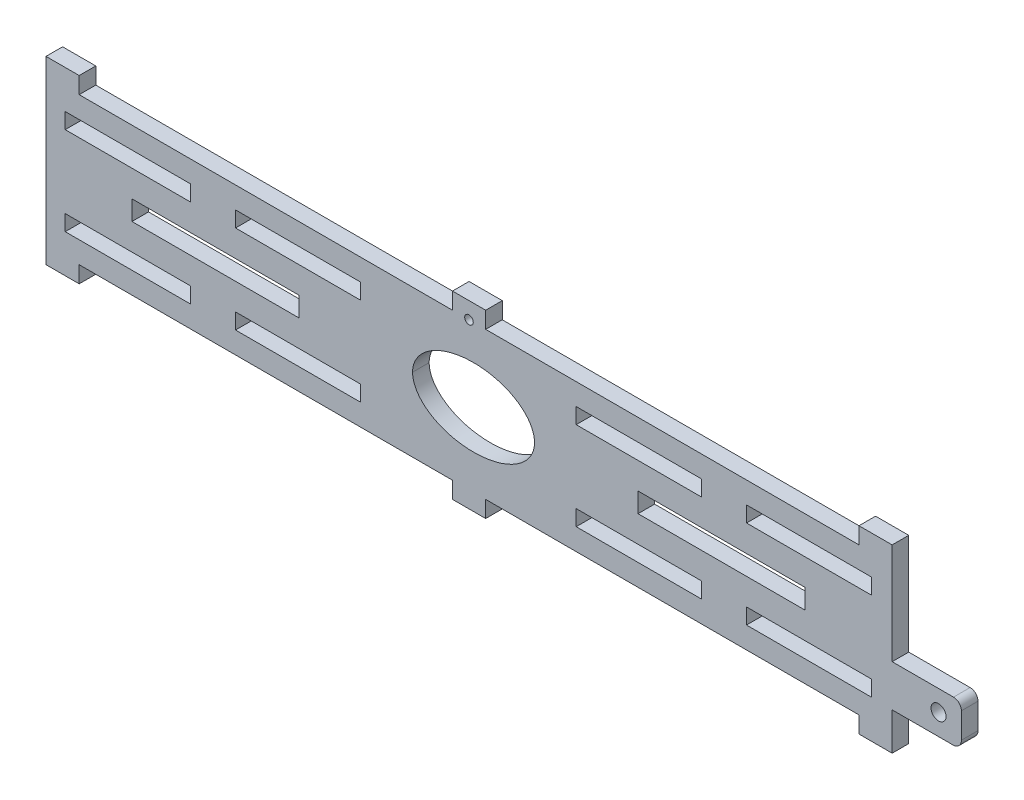
from build123d import *

# Parameters (mm, degrees)
SKETCH_1_R      = 0.515131583
SKETCH_1_R_2    = 0.905156807
SKETCH_1_W      = 20.114595703
SKETCH_1_H      = 2.368886762
SKETCH_1_W_2    = 15.085946791
SKETCH_1_H_2    = 1.892012434
SKETCH_1_W_3    = 15.085946792
SKETCH_1_W_4    = 20.114595731
EXTRUDE_1_DEPTH = 2


with BuildPart() as part:
    # 草图1 → 凸台-拉伸1 (new body)
    with BuildSketch(Plane.XY):
        with BuildLine():
            Line((-50.190600039, 8.875), (-50.190600039, 10.875))
            Line((-50.190600039, 10.875), (-54.190600039, 10.875))
            Line((-54.190600039, 10.875), (-54.190600039, -10.875))
            Line((-54.190600039, -10.875), (-50.190600039, -10.875))
            Line((-50.190600039, -10.875), (-50.190600039, -8.875))
            Line((-50.190600039, -8.875), (-5.190600039, -8.875))
            Line((-5.190600039, -8.875), (-5.190600039, -10.875))
            Line((-5.190600039, -10.875), (-1.190600039, -10.875))
            Line((-1.190600039, -10.875), (-1.190600039, -8.875))
            Line((-1.190600039, -8.875), (43.809399961, -8.875))
            Line((43.809399961, -8.875), (43.809399961, -10.875))
            Line((43.809399961, -10.875), (47.809399961, -10.875))
            Line((47.809399961, -10.875), (47.809399961, -6.347874739))
            Line((47.809399961, -6.347874739), (55.152023354, -6.347874739))
            ThreePointArc((55.152023354, -6.347874739), (55.863181706, -6.053303305), (56.15775314, -5.342144953))
            Line((56.15775314, -5.342144953), (56.15775314, -2.27022032))
            ThreePointArc((56.15775314, -2.27022032), (55.879213296, -1.597765651), (55.206758627, -1.319225807))
            Line((55.206758627, -1.319225807), (47.809399961, -1.319225807))
            Line((47.809399961, -1.319225807), (47.809399961, 10.875))
            Line((47.809399961, 10.875), (43.809399961, 10.875))
            Line((43.809399961, 10.875), (43.809399961, 8.875))
            Line((43.809399961, 8.875), (-1.190600039, 8.875))
            Line((-1.190600039, 8.875), (-1.190600039, 10.875))
            Line((-1.190600039, 10.875), (-5.190600039, 10.875))
            Line((-5.190600039, 10.875), (-5.190600039, 8.875))
            Line((-5.190600039, 8.875), (-50.190600039, 8.875))
        make_face()
        with Locations((-3.201829172, 8.8715913)):
            Circle(SKETCH_1_R, mode=Mode.SUBTRACT)
        with Locations((53.398961702, -3.806182637)):
            Circle(SKETCH_1_R_2, mode=Mode.SUBTRACT)
        with Locations((27.235161442, 0)):
            Rectangle(SKETCH_1_W, SKETCH_1_H, mode=Mode.SUBTRACT)
        with Locations((37.795324202, -5.325848376)):
            Rectangle(SKETCH_1_W_2, SKETCH_1_H_2, mode=Mode.SUBTRACT)
        with Locations((17.263351195, -5.325848376)):
            Rectangle(SKETCH_1_W_3, SKETCH_1_H_2, mode=Mode.SUBTRACT)
        with Locations((-23.800594817, -5.325848376)):
            Rectangle(SKETCH_1_W_2, SKETCH_1_H_2, mode=Mode.SUBTRACT)
        with Locations((-44.332567795, -5.325848376)):
            Rectangle(SKETCH_1_W_3, SKETCH_1_H_2, mode=Mode.SUBTRACT)
        with Locations((-33.77240505, 0)):
            Rectangle(SKETCH_1_W_4, SKETCH_1_H, mode=Mode.SUBTRACT)
        with Locations((37.795324202, 5.325848376)):
            Rectangle(SKETCH_1_W_2, SKETCH_1_H_2, mode=Mode.SUBTRACT)
        with Locations((17.263351195, 5.325848376)):
            Rectangle(SKETCH_1_W_3, SKETCH_1_H_2, mode=Mode.SUBTRACT)
        with Locations((-23.800594817, 5.325848376)):
            Rectangle(SKETCH_1_W_2, SKETCH_1_H_2, mode=Mode.SUBTRACT)
        with Locations((-44.332567795, 5.325848376)):
            Rectangle(SKETCH_1_W_3, SKETCH_1_H_2, mode=Mode.SUBTRACT)
        with BuildLine():
            add(Edge.make_bspline(
                [(-10.001566069, 0), (-10.001566069, -9.353540745), (4.696855103, -9.353540745), (4.696855103, 0)],
                knots=[0, 0, 0, 0, 1, 1, 1, 1], degree=3, weights=[1, 0.333333333, 0.333333333, 1]))
            add(Edge.make_bspline(
                [(4.696855103, 0), (4.696855103, 9.353540745), (-10.001566069, 9.353540745), (-10.001566069, 0)],
                knots=[0, 0, 0, 0, 1, 1, 1, 1], degree=3, weights=[1, 0.333333333, 0.333333333, 1]))
        make_face(mode=Mode.SUBTRACT)
    extrude(amount=EXTRUDE_1_DEPTH)


solid = part.part
